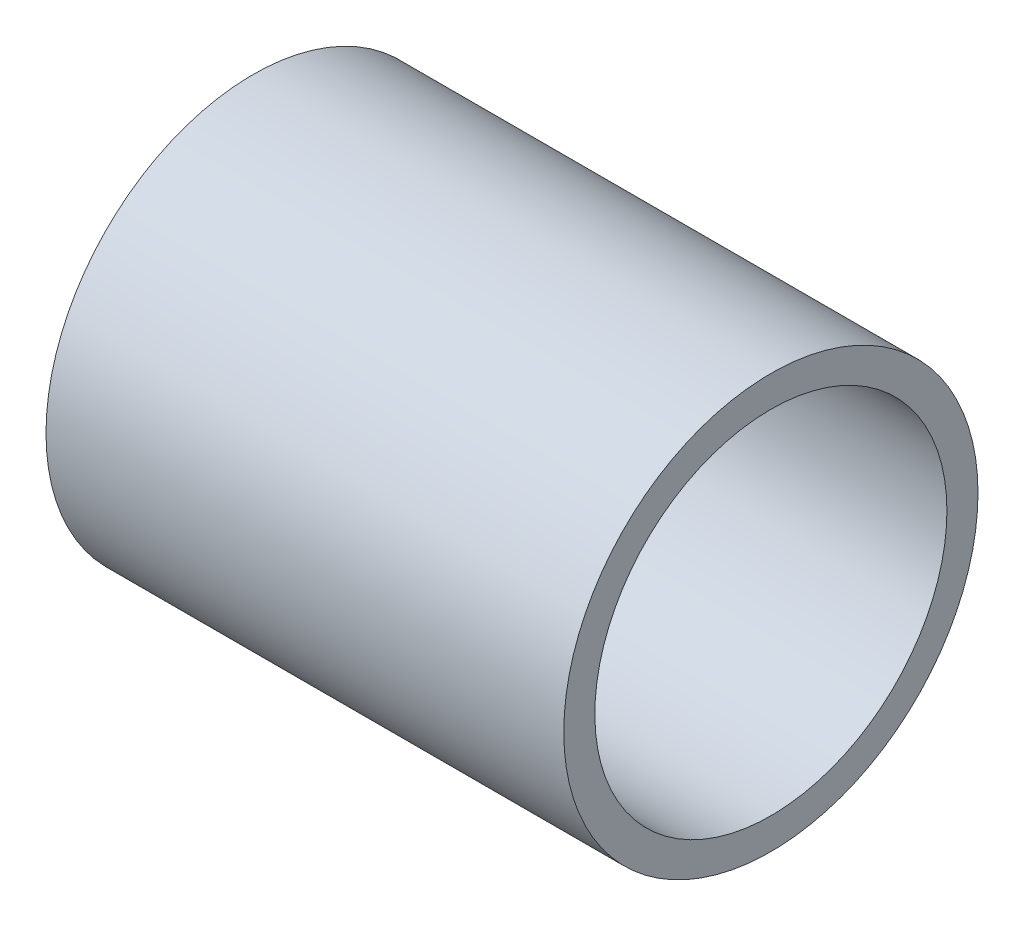
from build123d import *

# Parameters (mm, degrees)
SKETCH_1_R      = 10
SKETCH_1_R_2    = 8.5
EXTRUDE_1_DEPTH = 20
EXTRUDE_7_DEPTH = 5
EXTRUDE_START   = 5
SKETCH_4_R      = 10
SKETCH_4_R_2    = 8.5
EXTRUDE_8_DEPTH = 5


with BuildPart() as part:
    # 草圖1 → 填料-伸長1 (new body)
    with BuildSketch(Plane(origin=(0, 0, 0), x_dir=(0, 0, -1), z_dir=(1, 0, 0))):
        Circle(SKETCH_1_R)
        Circle(SKETCH_1_R_2, mode=Mode.SUBTRACT)
    extrude(amount=EXTRUDE_1_DEPTH)



with BuildPart() as body_2:
    # 草圖2 → 填料-伸長7 (new body)
    with BuildSketch(Plane.ZY):
        with BuildLine():
            ThreePointArc((8.5, 0), (4.563441684, 7.171122646), (-3.6, 7.7))
            Line((-3.6, 7.7), (-3.6, 0))
            Line((-3.6, 0), (-3.6, -7.7))
            ThreePointArc((-3.6, -7.7), (4.563441684, -7.171122646), (8.5, 0))
        make_face()
    extrude(amount=EXTRUDE_7_DEPTH)


with BuildPart() as part_1:
    add(part.part)

    add(body_2.part)  # 填料-伸長8 merges body 2
    # 草圖4 → 填料-伸長8 (add)
    with BuildSketch(Plane.ZY.offset(EXTRUDE_START)):
        Circle(SKETCH_4_R)
        with Locations(Location((0, 0, 0), (0, 0, 244.942384582))):
            Circle(SKETCH_4_R_2, mode=Mode.SUBTRACT)
    extrude(amount=-EXTRUDE_8_DEPTH)


solid = part_1.part
